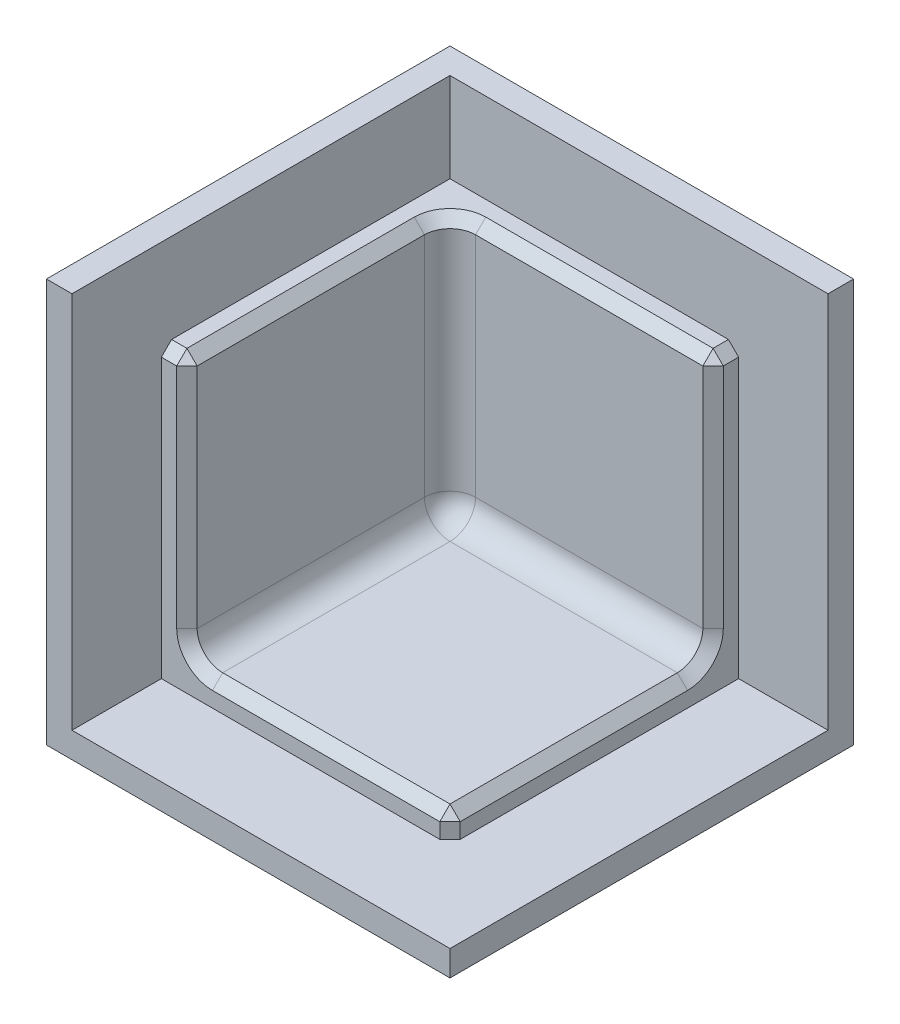
from build123d import *

# Parameters (mm, degrees)
ESQUISSE1_W                  = 15.8
ESQUISSE1_H                  = 15.8
BOSS_EXTRU_1_DEPTH           = 15.8
COQUE1_T                     = -2
ENL_V_MAT_EXTRU_1_DEPTH      = 3.5
ENL_V_MAT_EXTRU_2_DEPTH      = 3.5
ENL_V_MAT_EXTRU_3_DEPTH      = 24.7
ENL_V_MAT_EXTRU_3_DEPTH_BACK = 3.5
CONG_1_R                     = 1
CHANFREIN1_SIZE              = 0.4


with BuildPart() as part:
    # Esquisse1 → Boss.-Extru.1 (new body)
    with BuildSketch(Plane(origin=(0, 0, 0), x_dir=(1, 0, 0), z_dir=(0, 1, 0))):
        Rectangle(ESQUISSE1_W, ESQUISSE1_H)
    extrude(amount=BOSS_EXTRU_1_DEPTH)

    # Coque1
    coque1_openings = [part.faces().sort_by_distance(p)[0] for p in [
        (0, 15.8, 0),
        (0, 7.9, 7.9),
        (7.9, 7.9, 0),
    ]]
    offset(amount=COQUE1_T, openings=coque1_openings, kind=Kind.INTERSECTION)

    # Esquisse2 → Enlèv. mat.-Extru.1 (cut)
    with BuildSketch(Plane.XY.offset(7.9)):
        Polygon((-5.9, 15.8), (-6.9, 15.8), (-6.9, 1), (7.9, 1), (7.9, 2), (-5.9, 2), align=None)
    extrude(amount=-ENL_V_MAT_EXTRU_1_DEPTH, mode=Mode.SUBTRACT)

    # Esquisse6 → Enlèv. mat.-Extru.2 (cut)
    with BuildSketch(Plane(origin=(0, 15.8, 0), x_dir=(1, 0, 0), z_dir=(0, 1, 0))):
        Polygon((-5.9, -4.4), (-5.9, 5.9), (7.9, 5.9), (7.9, 6.9), (-6.9, 6.9), (-6.9, -4.4), align=None)
    extrude(amount=-ENL_V_MAT_EXTRU_2_DEPTH, mode=Mode.SUBTRACT)

    # Esquisse7 → Enlèv. mat.-Extru.3 (cut, two sides: drawn at the far end of the back side and taken through both)
    with BuildSketch(Plane(origin=(7.9, 0, 0), x_dir=(0, 0, -1), z_dir=(1, 0, 0)).offset(-ENL_V_MAT_EXTRU_3_DEPTH_BACK)):
        Polygon((5.9, 2), (-4.4, 2), (-4.4, 1), (6.9, 1), (6.9, 12.3), (5.9, 12.3), align=None)
    extrude(amount=ENL_V_MAT_EXTRU_3_DEPTH + ENL_V_MAT_EXTRU_3_DEPTH_BACK, mode=Mode.SUBTRACT)

    # Congé1
    cong_1_edges = [part.edges().sort_by_distance(p)[0] for p in [
        (-5.9, 2, -0.75),
        (-5.9, 7.15, -5.9),
        (-0.75, 2, -5.9),
    ]]
    fillet(cong_1_edges, radius=CONG_1_R)

    # Chanfrein1
    chanfrein1_edges = [part.edges().sort_by_distance(p)[0] for p in [
        (-5.9, 7.65, 4.4),
        (-6.4, 12.3, 4.4),
        (-5.9, 12.3, -0.25),
        (-0.25, 2, 4.4),
        (4.4, 2, -0.25),
        (4.4, 12.3, -6.4),
        (4.4, 1.5, 4.4),
        (4.4, 7.65, -5.9),
        (-0.25, 12.3, -5.9),
        (-5.607106781, 12.3, -5.607106781),
        (4.4, 2.292893219, -5.607106781),
        (-5.607106781, 2.292893219, 4.4),
    ]]
    chamfer(chanfrein1_edges, length=CHANFREIN1_SIZE)


solid = part.part
